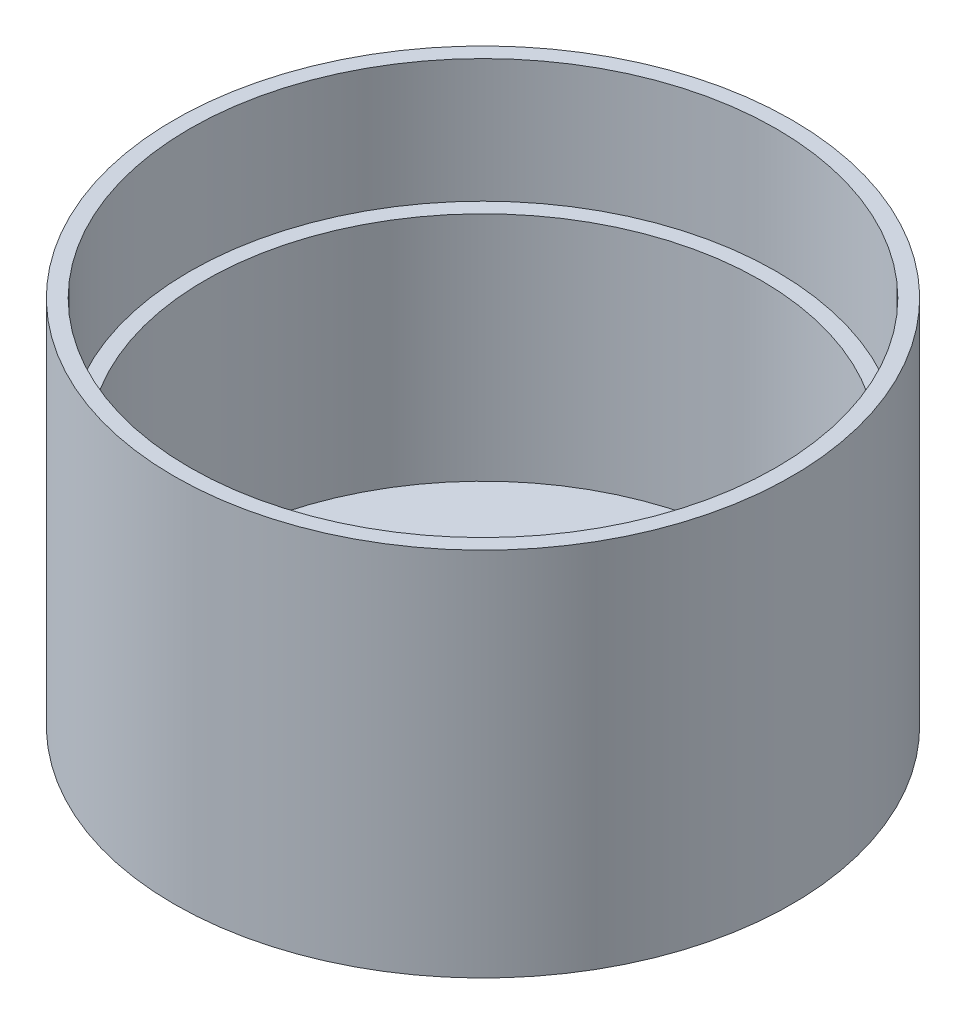
from build123d import *

# Parameters (mm, degrees)
SKETCH1_R           = 63.5
BOSS_EXTRUDE1_DEPTH = 76.2
SKETCH2_R           = 57.15
CUT_EXTRUDE1_DEPTH  = 73.025
SKETCH3_R           = 60.325
CUT_EXTRUDE2_DEPTH  = 25.4


with BuildPart() as part:
    # Sketch1 → Boss-Extrude1 (new body)
    with BuildSketch(Plane(origin=(0, 0, 0), x_dir=(1, 0, 0), z_dir=(0, 1, 0))):
        with Locations(Location((0, 0, 0), (0, 0, 90))):
            Circle(SKETCH1_R)
    extrude(amount=BOSS_EXTRUDE1_DEPTH)

    # Sketch2 → Cut-Extrude1 (cut)
    with BuildSketch(Plane(origin=(0, 76.2, 0), x_dir=(1, 0, 0), z_dir=(0, 1, 0))):
        with Locations(Location((0, 0, 0), (0, 0, 270))):
            Circle(SKETCH2_R)
    extrude(amount=-CUT_EXTRUDE1_DEPTH, mode=Mode.SUBTRACT)

    # Sketch3 → Cut-Extrude2 (cut)
    with BuildSketch(Plane(origin=(0, 76.2, 0), x_dir=(1, 0, 0), z_dir=(0, 1, 0))):
        with Locations(Location((0, 0, 0), (0, 0, 270))):
            Circle(SKETCH3_R)
    extrude(amount=-CUT_EXTRUDE2_DEPTH, mode=Mode.SUBTRACT)


solid = part.part
